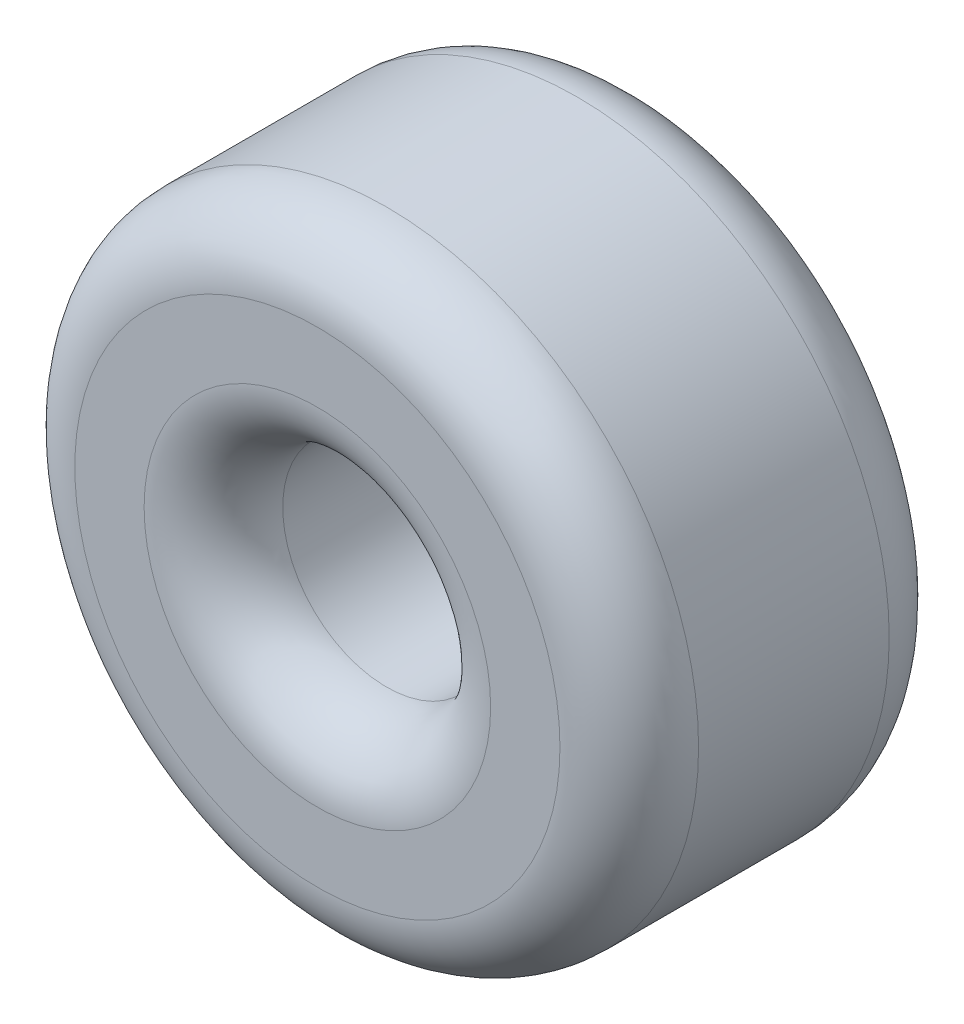
from build123d import *

# Parameters (mm, degrees)
SKETCH1_R           = 9
SKETCH1_R_2         = 3
BOSS_EXTRUDE1_DEPTH = 9.5
FILLET1_R           = 2
FILLET2_R           = 2
SCALE1_SCALE        = 0.5


with BuildPart() as part:
    # Sketch1 → Boss-Extrude1 (new body)
    with BuildSketch(Plane.XY):
        Circle(SKETCH1_R)
        Circle(SKETCH1_R_2, mode=Mode.SUBTRACT)
    extrude(amount=BOSS_EXTRUDE1_DEPTH)

    # Fillet1
    fillet1_edges = [part.edges().sort_by_distance(p)[0] for p in [
        (-3, 0, 0),
        (-3, 0, 9.5),
    ]]
    fillet(fillet1_edges, radius=FILLET1_R)

    # Fillet2
    fillet2_edges = [part.edges().sort_by_distance(p)[0] for p in [
        (-9, 0, 0),
        (-9, 0, 9.5),
    ]]
    fillet(fillet2_edges, radius=FILLET2_R)


with BuildPart() as part_1:
    # Scale1: scaled about (0, 0, 0)
    add(part.part.scale(SCALE1_SCALE))


solid = part_1.part
